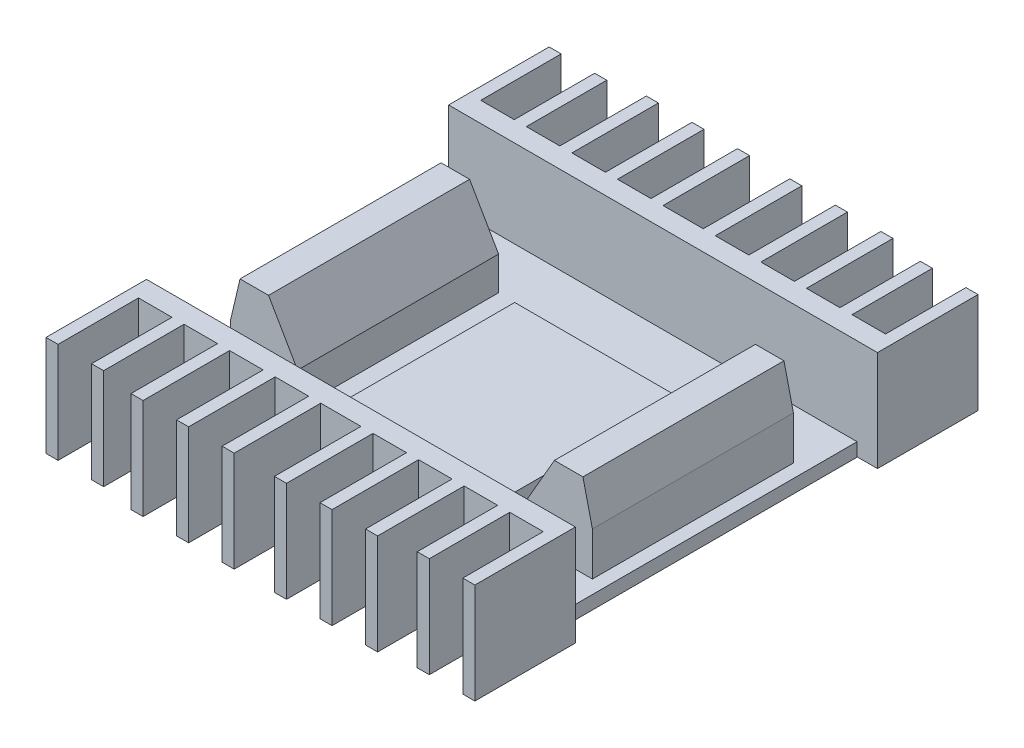
from build123d import *

# Parameters (mm, degrees)
SKETCH2_W             = 58
SKETCH2_H             = 45
BOSS_EXTRUDE1_DEPTH   = 2
BOSS_EXTRUDE2_DEPTH   = 15
BOSS_EXTRUDE2_2_DEPTH = 15
BOSS_EXTRUDE3_DEPTH   = 30
SKETCH5_W             = 24.518025474
SKETCH5_H             = 26.342622719
BOSS_EXTRUDE4_DEPTH   = 2


with BuildPart() as part:
    # Sketch2 → Boss-Extrude1 (new body)
    with BuildSketch(Plane(origin=(0, 0, 0), x_dir=(1, 0, 0), z_dir=(0, 1, 0))):
        with Locations((-28.579660082, -22.5)):
            Rectangle(SKETCH2_W, SKETCH2_H)
    extrude(amount=BOSS_EXTRUDE1_DEPTH)

    # Sketch4 → Boss-Extrude3 (add)
    with BuildSketch(Plane.XY.offset(7.5)):
        Polygon((-1.579660082, 2), (-11.579660082, 2), (-11.579660082, 7), (-7.249533064, 14.5), (-2.99635519, 14.5), (-1.579660082, 8.476286332), align=None)
        Polygon((-55.579660082, 8.476286332), (-55.579660082, 2), (-45.579660082, 2), (-45.579660082, 7), (-49.909787101, 14.5), (-54.162964975, 14.5), align=None)
    extrude(amount=BOSS_EXTRUDE3_DEPTH)

    # Sketch5 → Boss-Extrude4 (add)
    with BuildSketch(Plane(origin=(0, 2, 0), x_dir=(1, 0, 0), z_dir=(0, 1, 0))):
        with Locations((-28.864753402, -22.728074656)):
            Rectangle(SKETCH5_W, SKETCH5_H)
    extrude(amount=BOSS_EXTRUDE4_DEPTH)


with BuildPart() as body_2:
    # Sketch3 → Boss-Extrude2 (new body)
    with BuildSketch(Plane(origin=(0, 0, 0), x_dir=(1, 0, 0), z_dir=(0, 1, 0))):
        Polygon((3.420339918, -45.039874663), (-60.579660082, -45.039874663), (-60.579660082, -60.039874663), (-58.779660082, -60.039874663), (-58.779660082, -48.039874663), (-53.779660082, -48.039874663), (-53.779660082, -60.039874663), (-51.979660082, -60.039874663), (-51.979660082, -48.039874663), (-46.979660082, -48.039874663), (-46.979660082, -60.953661468), (-45.179660082, -60.953661468), (-45.179660082, -48.039874663), (-40.179660082, -48.039874663), (-40.179660082, -60.953661468), (-38.379660082, -60.953661468), (-38.379660082, -48.039874663), (-33.379660082, -48.039874663), (-33.379660082, -60.953661468), (-31.579660082, -60.953661468), (-31.579660082, -48.039874663), (-25.579660082, -48.039874663), (-25.579660082, -60.953661468), (-23.779660082, -60.953661468), (-23.779660082, -48.039874663), (-18.779660082, -48.039874663), (-18.779660082, -60.953661468), (-16.979660082, -60.953661468), (-16.979660082, -48.039874663), (-11.979660082, -48.039874663), (-11.979660082, -60.953661468), (-10.179660082, -60.953661468), (-10.179660082, -48.039874663), (-5.179660082, -48.039874663), (-5.179660082, -60.039874663), (-3.379660082, -60.039874663), (-3.379660082, -48.039874663), (1.620339918, -48.039874663), (1.620339918, -60.039874663), (3.420339918, -60.039874663), align=None)
    extrude(amount=BOSS_EXTRUDE2_DEPTH)


with BuildPart() as body_3:
    # Sketch3 → Boss-Extrude2 2 (new body)
    with BuildSketch(Plane(origin=(0, 0, 0), x_dir=(1, 0, 0), z_dir=(0, 1, 0))):
        Polygon((-60.579660082, 15.039874663), (-58.779660082, 15.039874663), (-58.779660082, 3.039874663), (-53.779660082, 3.039874663), (-53.779660082, 15.039874663), (-51.979660082, 15.039874663), (-51.979660082, 3.039874663), (-46.979660082, 3.039874663), (-46.979660082, 15.953661468), (-45.179660082, 15.953661468), (-45.179660082, 3.039874663), (-40.179660082, 3.039874663), (-40.179660082, 15.953661468), (-38.379660082, 15.953661468), (-38.379660082, 3.039874663), (-33.379660082, 3.039874663), (-33.379660082, 15.953661468), (-31.579660082, 15.953661468), (-31.579660082, 3.039874663), (-25.579660082, 3.039874663), (-25.579660082, 15.953661468), (-23.779660082, 15.953661468), (-23.779660082, 3.039874663), (-18.779660082, 3.039874663), (-18.779660082, 15.953661468), (-16.979660082, 15.953661468), (-16.979660082, 3.039874663), (-11.979660082, 3.039874663), (-11.979660082, 15.953661468), (-10.179660082, 15.953661468), (-10.179660082, 3.039874663), (-5.179660082, 3.039874663), (-5.179660082, 15.039874663), (-3.379660082, 15.039874663), (-3.379660082, 3.039874663), (1.620339918, 3.039874663), (1.620339918, 15.039874663), (3.420339918, 15.039874663), (3.420339918, 0.039874663), (-60.579660082, 0.039874663), align=None)
    extrude(amount=BOSS_EXTRUDE2_2_DEPTH)


solid = Compound([part.part, body_2.part, body_3.part])
